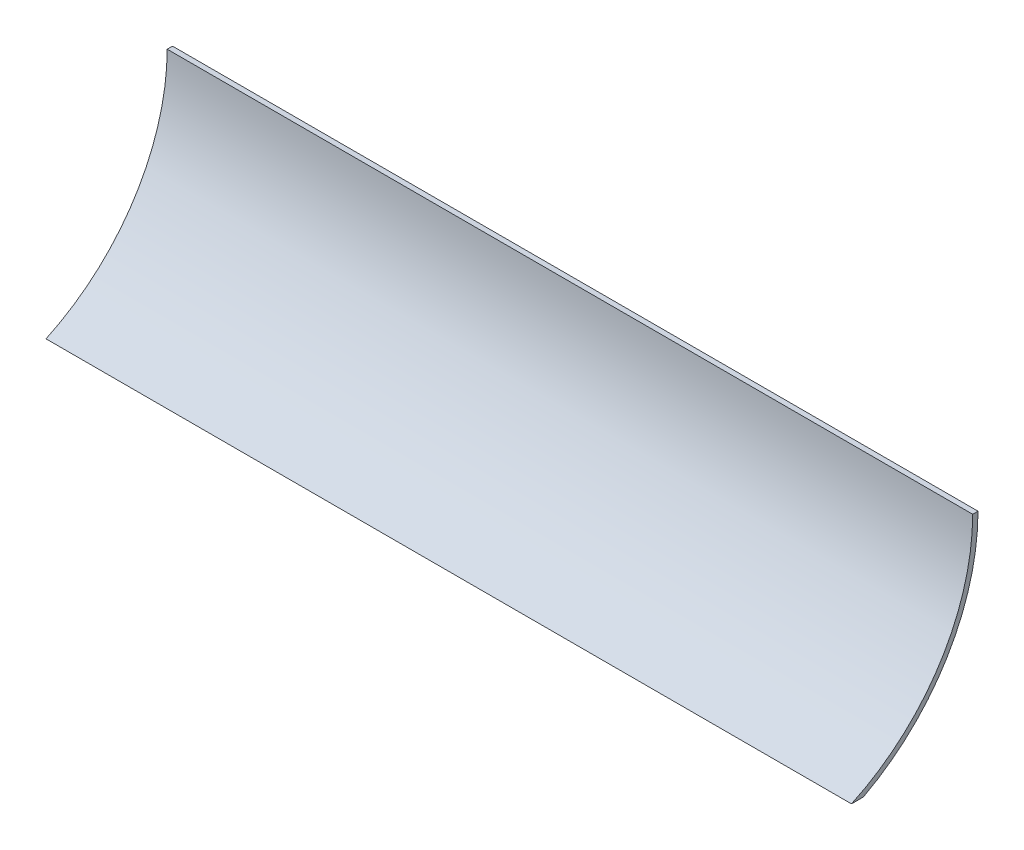
from build123d import *

# Parameters (mm, degrees)
EXTRUDE_THIN1_DEPTH = 192.5
CUT_EXTRUDE1_DEPTH  = 410.266930903
BOSS_EXTRUDE1_REACH = 238.446
SKETCH3_R           = 6.35


with BuildPart() as part:
    # Sketch1 → Extrude-Thin1 (new, symmetric)
    with BuildSketch(Plane(origin=(0, 0, 0), x_dir=(0, 0, -1), z_dir=(1, 0, 0))):
        with BuildLine():
            ThreePointArc((43.474740585, -93.231882052), (86.759678031, -55.272010711), (102.87, 0))
            Line((102.87, 0), (100.33, 0))
            ThreePointArc((100.33, 0), (84.617463758, -53.907269705), (42.4012902, -90.929860273))
            Line((42.4012902, -90.929860273), (43.474740585, -93.231882052))
        make_face()
    extrude(amount=EXTRUDE_THIN1_DEPTH, both=True)

    # Sketch2 → Cut-Extrude1 (cut, through all)
    with BuildSketch(Plane(origin=(192.5, 0, 0), x_dir=(0, 0, -1), z_dir=(1, 0, 0))):
        with BuildLine():
            Line((42.4012902, -90.929860273), (48.104026969, -90.929860273))
            ThreePointArc((48.104026969, -90.929860273), (45.803848013, -92.109958241), (43.474740585, -93.231882052))
            Line((43.474740585, -93.231882052), (42.4012902, -90.929860273))
        make_face()
    extrude(amount=-CUT_EXTRUDE1_DEPTH, mode=Mode.SUBTRACT)

    # Sketch3 → Boss-Extrude1 (add, up to next)
    with BuildSketch(Plane.XZ.offset(90.929860273), mode=Mode.PRIVATE) as boss_extrude1_sk1:
        with Locations(Location((-129, -96.52, 0), (0, 0, 270))):
            Circle(SKETCH3_R)
    boss_extrude1_tool1 = extrude(boss_extrude1_sk1.sketch, amount=-BOSS_EXTRUDE1_REACH, mode=Mode.PRIVATE) - part.part
    # Sketch3 → Boss-Extrude1 (add, up to next)
    with BuildSketch(Plane.XZ.offset(90.929860273), mode=Mode.PRIVATE) as boss_extrude1_sk2:
        with Locations(Location((129, -96.52, 0), (0, 0, 270))):
            Circle(SKETCH3_R)
    boss_extrude1_tool2 = extrude(boss_extrude1_sk2.sketch, amount=-BOSS_EXTRUDE1_REACH, mode=Mode.PRIVATE) - part.part
    # Sketch3 → Boss-Extrude1 (add, up to next)
    with BuildSketch(Plane.XZ.offset(90.929860273), mode=Mode.PRIVATE) as boss_extrude1_sk3:
        with Locations(Location((0, -96.52, 0), (0, 0, 270))):
            Circle(SKETCH3_R)
    boss_extrude1_tool3 = extrude(boss_extrude1_sk3.sketch, amount=-BOSS_EXTRUDE1_REACH, mode=Mode.PRIVATE) - part.part
    add(boss_extrude1_tool1.solids().sort_by_distance((-129, -90.92986, -96.52))[0])
    add(boss_extrude1_tool2.solids().sort_by_distance((129, -90.92986, -96.52))[0])
    add(boss_extrude1_tool3.solids().sort_by_distance((0, -90.92986, -96.52))[0])


solid = part.part
